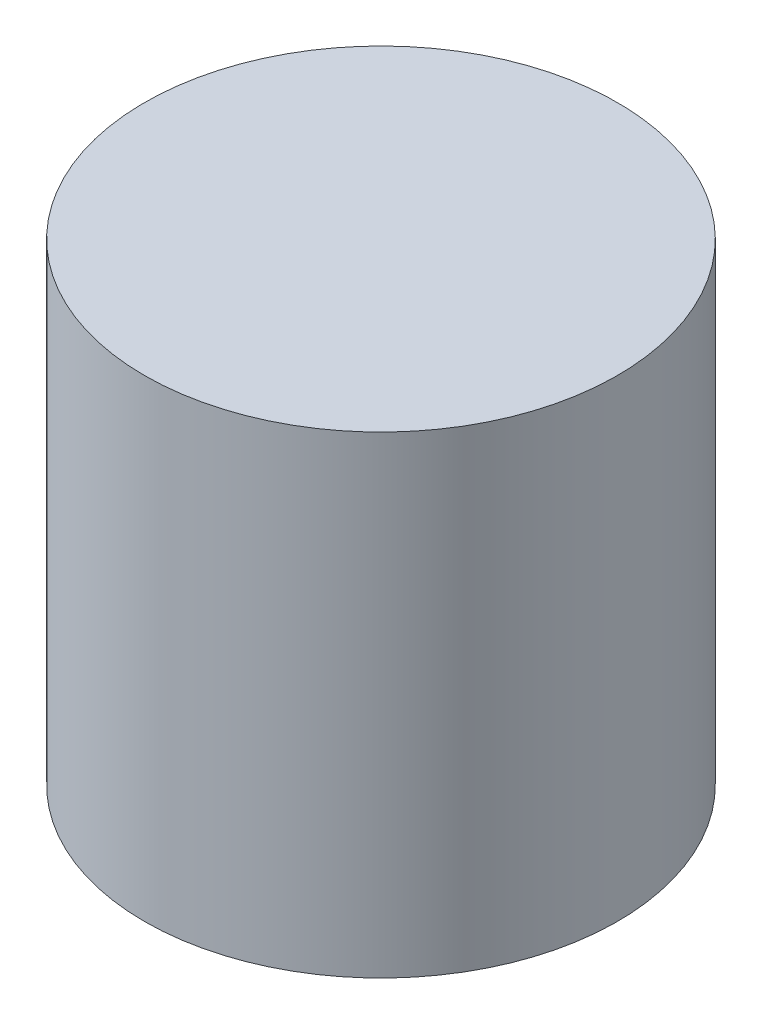
from build123d import *

# Parameters (mm, degrees)
SKETCH1_R           = 3.175
BOSS_EXTRUDE1_DEPTH = 6.35


with BuildPart() as part:
    # Sketch1 → Boss-Extrude1 (new body)
    with BuildSketch(Plane(origin=(0, 0, 0), x_dir=(1, 0, 0), z_dir=(0, 1, 0))):
        with Locations(Location((0, 0, 0), (0, 0, 270))):
            Circle(SKETCH1_R)
    extrude(amount=BOSS_EXTRUDE1_DEPTH)


solid = part.part
